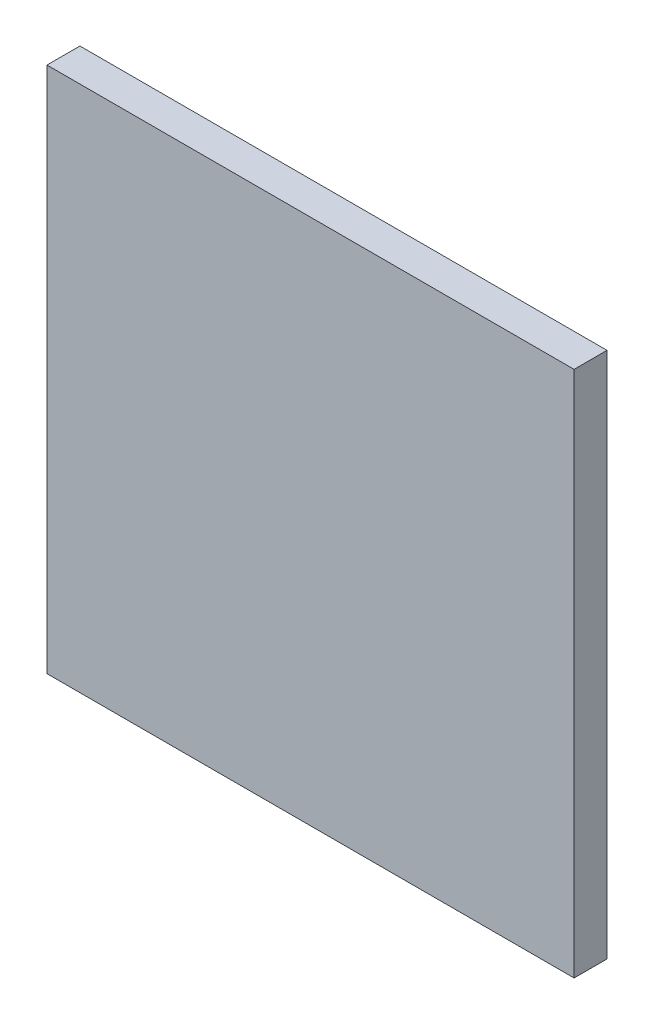
from build123d import *

# Parameters (mm, degrees)
ESBO_O1_W                = 400
ESBO_O1_H                = 400
RESSALTO_EXTRUS_O1_DEPTH = 25
ESBO_O2_W                = 50
ESBO_O2_H                = 50
RESSALTO_EXTRUS_O3_DEPTH = 30
ESBO_O3_W                = 400
ESBO_O3_H                = 5
CORTE_EXTRUS_O1_DEPTH    = 458.682719878


with BuildPart() as part:
    # Esboço1 → Ressalto-extrusão1 (new body)
    with BuildSketch(Plane.XY):
        with Locations((-21.016904501, -40.4)):
            Rectangle(ESBO_O1_W, ESBO_O1_H)
    extrude(amount=RESSALTO_EXTRUS_O1_DEPTH)

    # Esboço2 → Ressalto-extrusão3 (add)
    with BuildSketch(Plane.XY.offset(25)):
        with Locations((-196.016904501, 134.6)):
            Rectangle(ESBO_O2_W, ESBO_O2_H)
        with Locations((-96.016904501, 34.6)):
            Rectangle(ESBO_O2_W, ESBO_O2_H)
        with Locations((3.983095499, -65.4)):
            Rectangle(ESBO_O2_W, ESBO_O2_H)
        with Locations((104.55184435, -165.4)):
            Rectangle(ESBO_O2_W, ESBO_O2_H)
        with Locations((-196.016904501, -165.4)):
            Rectangle(ESBO_O2_W, ESBO_O2_H)
        with Locations((-196.016904501, -65.4)):
            Rectangle(ESBO_O2_W, ESBO_O2_H)
        with Locations((-96.016904501, -215.4)):
            Rectangle(ESBO_O2_W, ESBO_O2_H)
        with Locations((3.983095499, -215.4)):
            Rectangle(ESBO_O2_W, ESBO_O2_H)
        with Locations((-97.204301074, 134.6)):
            Rectangle(ESBO_O2_W, ESBO_O2_H)
        with Locations((4.217571053, 134.6)):
            Rectangle(ESBO_O2_W, ESBO_O2_H)
        with Locations((-96.016904501, -65.4)):
            Rectangle(ESBO_O2_W, ESBO_O2_H)
        with Locations((153.983095499, 34.6)):
            Rectangle(ESBO_O2_W, ESBO_O2_H)
        with Locations((153.983095499, -65.4)):
            Rectangle(ESBO_O2_W, ESBO_O2_H)
        with Locations((53.983095499, 34.6)):
            Rectangle(ESBO_O2_W, ESBO_O2_H)
        with Locations((-196.016904501, 34.6)):
            Rectangle(ESBO_O2_W, ESBO_O2_H)
        with Locations((103.983095499, 134.6)):
            Rectangle(ESBO_O2_W, ESBO_O2_H)
    extrude(amount=-RESSALTO_EXTRUS_O3_DEPTH)

    # Esboço3 → Corte-extrusão1 (cut, through all)
    with BuildSketch(Plane(origin=(0, 159.6, 0), x_dir=(1, 0, 0), z_dir=(0, 1, 0))):
        with Locations((-21.016904501, 2.5)):
            Rectangle(ESBO_O3_W, ESBO_O3_H)
    extrude(amount=-CORTE_EXTRUS_O1_DEPTH, mode=Mode.SUBTRACT)


solid = part.part
